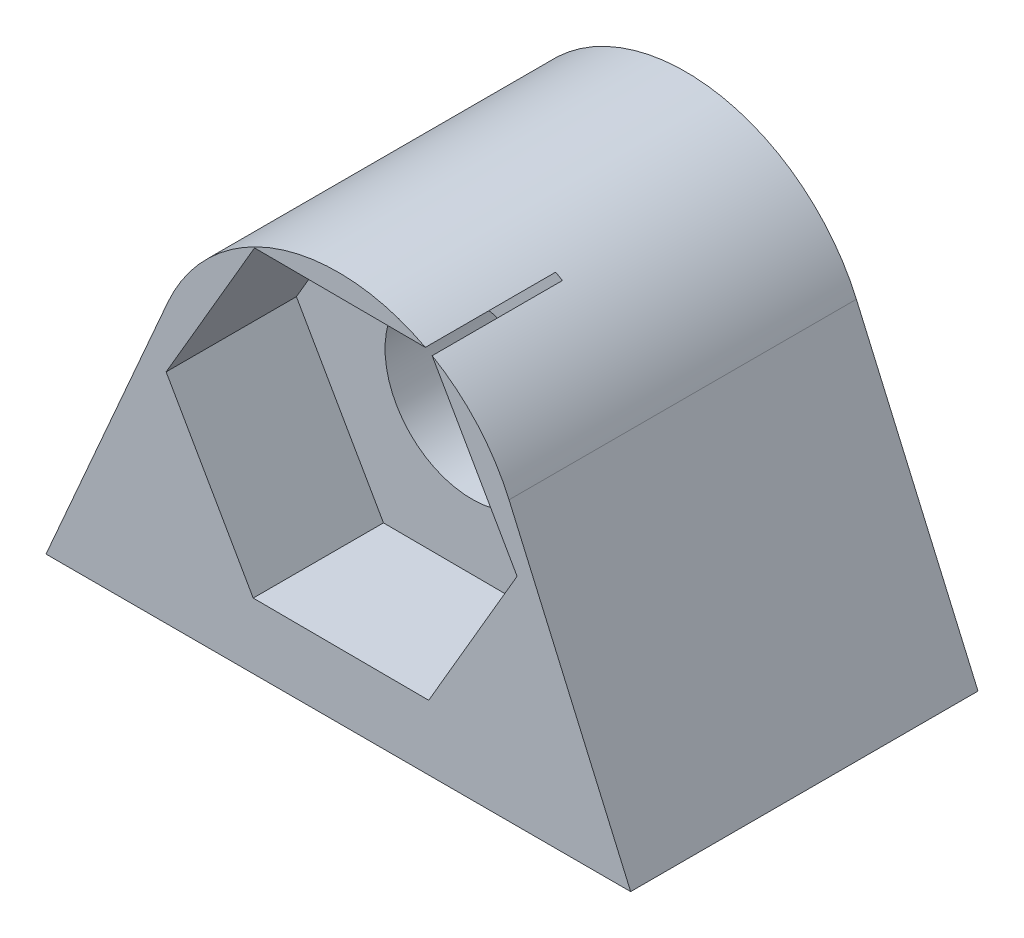
from build123d import *

# Parameters (mm, degrees)
CROQUIS1_R              = 2
SALIENTE_EXTRUIR1_DEPTH = 8
CORTAR_EXTRUIR1_DEPTH   = 3


with BuildPart() as part:
    # Croquis1 → Saliente-Extruir1 (new body)
    with BuildSketch(Plane.XY):
        with BuildLine():
            Line((0, 0), (-6.732907314, 0))
            Line((-6.732907314, 0), (-3.931702166, 6.415079868))
            ThreePointArc((-3.931702166, 6.415079868), (0, 8.988455594), (3.931702166, 6.415079868))
            Line((3.931702166, 6.415079868), (6.732907314, 0))
            Line((6.732907314, 0), (0, 0))
        make_face()
        with Locations((0.075747875, 5)):
            Circle(CROQUIS1_R, mode=Mode.SUBTRACT)
    extrude(amount=SALIENTE_EXTRUIR1_DEPTH)

    # Croquis2 → Cortar-Extruir1 (cut)
    with BuildSketch(Plane.XY.offset(8)):
        Polygon((-1.960251802, 1.508862843), (2.081161502, 1.491203979), (4.11716118, 4.982341136), (2.111747552, 8.491137157), (-1.929665752, 8.508796021), (-3.965665429, 5.017658864), align=None)
    extrude(amount=-CORTAR_EXTRUIR1_DEPTH, mode=Mode.SUBTRACT)


solid = part.part
